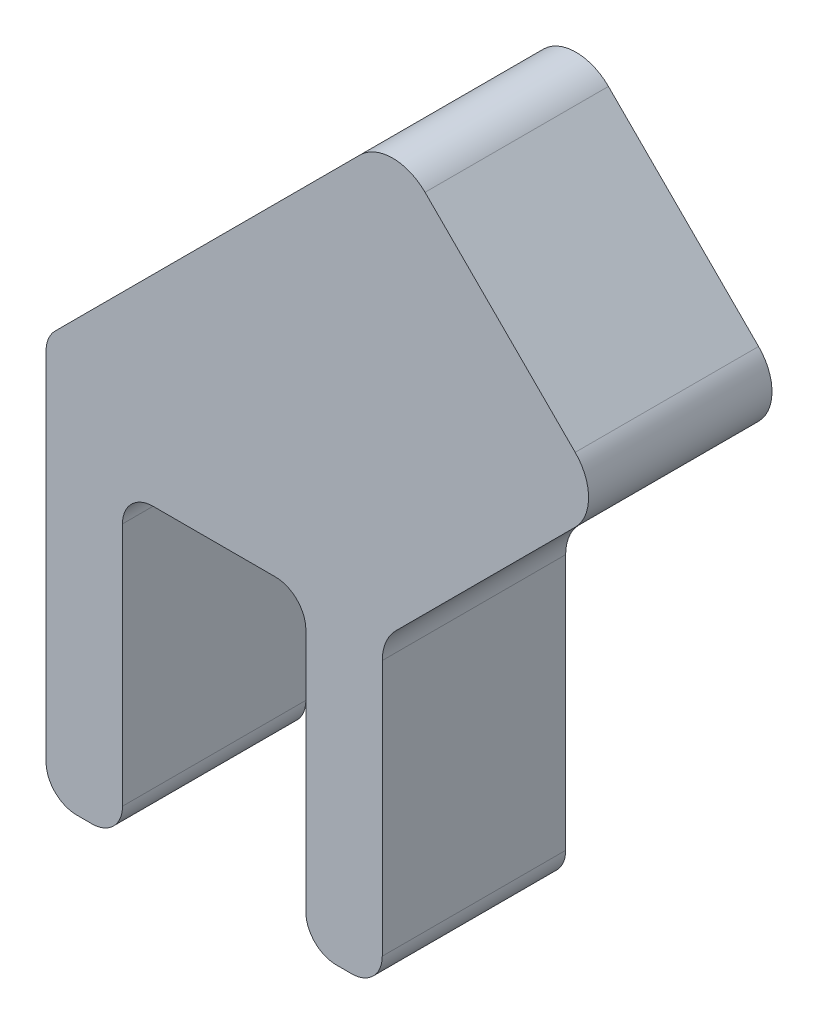
from build123d import *

# Parameters (mm, degrees)
EXTRUDE_1_DEPTH = 12
FILLET_1_R      = 2


with BuildPart() as part:
    # Эскиз1 → Бобышка-Вытянуть1 (new body)
    with BuildSketch(Plane.XY):
        with BuildLine():
            Line((0, 0), (5, 0))
            Line((5, 0), (5, 20))
            Line((5, 20), (17, 20))
            Line((17, 20), (17, 0))
            Line((17, 0), (22, 0))
            Line((22, 0), (22, 18.757359313))
            ThreePointArc((22, 18.757359313), (22.228361402, 19.90540961), (22.878679656, 20.878679656))
            Line((22.878679656, 20.878679656), (34.624442368, 32.624442368))
            ThreePointArc((34.624442368, 32.624442368), (35.503122025, 34.745762712), (34.624442368, 36.867083055))
            Line((34.624442368, 36.867083055), (24.799286445, 46.692238978))
            ThreePointArc((24.799286445, 46.692238978), (22.677966102, 47.570918635), (20.556645758, 46.692238978))
            Line((20.556645758, 46.692238978), (0, 26.13559322))
            Line((0, 26.13559322), (0, 0))
        make_face()
    extrude(amount=EXTRUDE_1_DEPTH)

    # Скругление1
    fillet_1_edges = [part.edges().sort_by_distance(p)[0] for p in [
        (0, 26.13559322, 6),
        (22, 0, 6),
        (17, 0, 6),
        (17, 20, 6),
        (5, 20, 6),
        (5, 0, 6),
        (0, 0, 6),
    ]]
    fillet(fillet_1_edges, radius=FILLET_1_R)


solid = part.part
